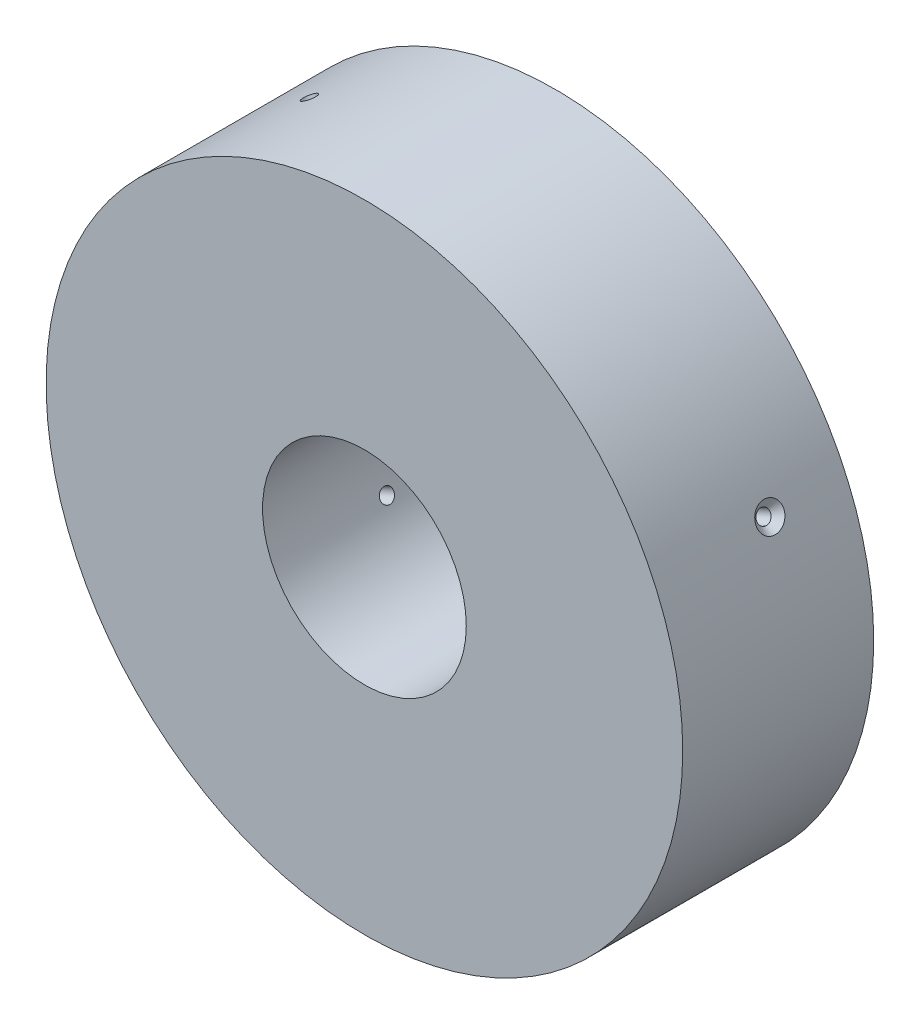
from build123d import *

# Parameters (mm, degrees)
SKETCH2_R                                           = 50
SKETCH2_R_2                                         = 16
BOSS_EXTRUDE1_DEPTH                                 = 30
CSK_FOR_M2_COUNTERSUNK_FLAT_HEAD_SCREW1_D           = 2.2
CSK_FOR_M2_COUNTERSUNK_FLAT_HEAD_SCREW1_CSINK_D     = 4.4
CSK_FOR_M2_COUNTERSUNK_FLAT_HEAD_SCREW1_CSINK_ANGLE = 90
CSK_FOR_M2_COUNTERSUNK_FLAT_HEAD_SCR_2_D            = 2.2
CSK_FOR_M2_COUNTERSUNK_FLAT_HEAD_SCR_2_CSINK_D      = 4.4
CSK_FOR_M2_COUNTERSUNK_FLAT_HEAD_SCR_2_CSINK_ANGLE  = 90


with BuildPart() as part:
    # Sketch2 → Boss-Extrude1 (new body)
    with BuildSketch(Plane.XY):
        Circle(SKETCH2_R)
        Circle(SKETCH2_R_2, mode=Mode.SUBTRACT)
    extrude(amount=BOSS_EXTRUDE1_DEPTH)

    # CSK for M2 Countersunk Flat Head Screw1 (through all)
    with Locations(Plane(origin=(24.873497254, -43.374060617, 13.771522771), x_dir=(-0.86748121233, -0.497469945076, 0), z_dir=(0.497469945076, -0.86748121233, 0))):
        with Locations((0, 0)):
            CounterSinkHole(CSK_FOR_M2_COUNTERSUNK_FLAT_HEAD_SCREW1_D / 2, CSK_FOR_M2_COUNTERSUNK_FLAT_HEAD_SCREW1_CSINK_D / 2, counter_sink_angle=CSK_FOR_M2_COUNTERSUNK_FLAT_HEAD_SCREW1_CSINK_ANGLE)

    # CSK for M2 Countersunk Flat Head Scr 2 (through all)
    with Locations(Plane(origin=(45.576703695, 20.561227598, 11.889158969), x_dir=(-0.411224951932, 0.91153389345, 0), z_dir=(0.91153389345, 0.411224951932, 0))):
        with Locations((0, 0)):
            CounterSinkHole(CSK_FOR_M2_COUNTERSUNK_FLAT_HEAD_SCR_2_D / 2, CSK_FOR_M2_COUNTERSUNK_FLAT_HEAD_SCR_2_CSINK_D / 2, counter_sink_angle=CSK_FOR_M2_COUNTERSUNK_FLAT_HEAD_SCR_2_CSINK_ANGLE)


solid = part.part
